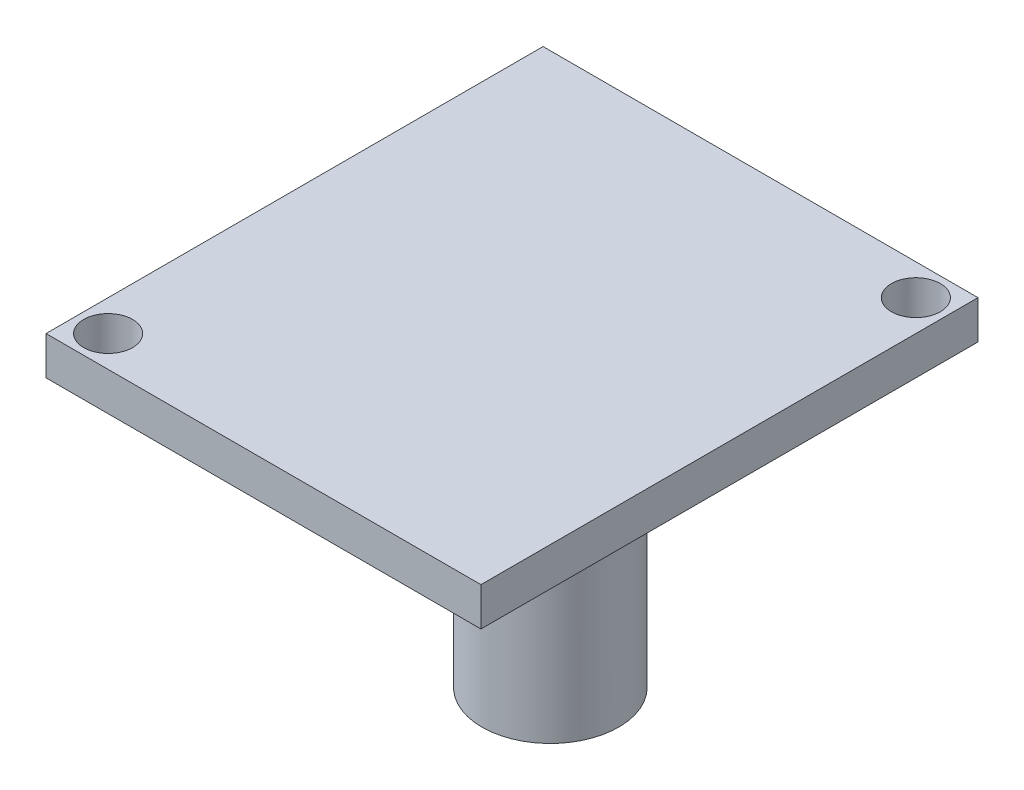
from build123d import *

# Parameters (mm, degrees)
SKETCH1_W           = 17.78
SKETCH1_H           = 20.32
BOSS_EXTRUDE1_DEPTH = 1.57
SKETCH2_R           = 2.797878481
BOSS_EXTRUDE2_DEPTH = 8.8
SKETCH3_R           = 1
CUT_EXTRUDE1_DEPTH  = 17.115138845


with BuildPart() as part:
    # Sketch1 → Boss-Extrude1 (new body)
    with BuildSketch(Plane(origin=(0, 0, 0), x_dir=(1, 0, 0), z_dir=(0, 1, 0))):
        Rectangle(SKETCH1_W, SKETCH1_H)
    extrude(amount=BOSS_EXTRUDE1_DEPTH)

    # Sketch2 → Boss-Extrude2 (add)
    with BuildSketch(Plane(origin=(0, 1.57, 0), x_dir=(1, 0, 0), z_dir=(0, 1, 0))):
        with Locations(Location((5.155350165, -3.588020089, 0), (0, 0, 270))):
            Circle(SKETCH2_R)
        with Locations(Location((-5.051725036, 0, 0), (0, 0, 270))):
            Circle(SKETCH2_R)
    extrude(amount=-BOSS_EXTRUDE2_DEPTH)

    # Sketch3 → Cut-Extrude1 (cut, through all)
    with BuildSketch(Plane(origin=(0, 1.57, 0), x_dir=(1, 0, 0), z_dir=(0, 1, 0))):
        with Locations(Location((-7.62, -8.89, 0), (0, 0, 270))):
            Circle(SKETCH3_R)
        with Locations(Location((7.62, 8.89, 0), (0, 0, 270))):
            Circle(SKETCH3_R)
    extrude(amount=-CUT_EXTRUDE1_DEPTH, mode=Mode.SUBTRACT)


solid = part.part
